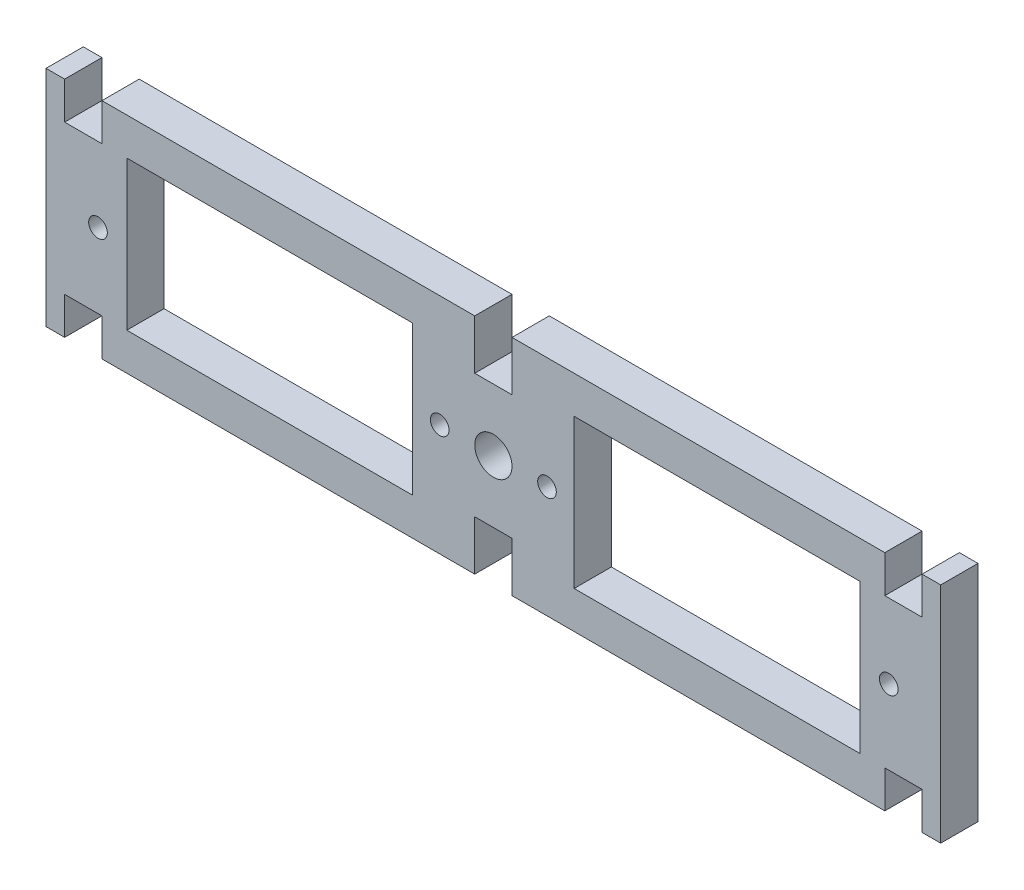
from build123d import *

# Parameters (mm, degrees)
SKETCH_1_R      = 1.499696603
SKETCH_1_R_2    = 0.75
EXTRUDE_1_DEPTH = 3


with BuildPart() as part:
    # 草图1 → 凸台-拉伸1 (new body)
    with BuildSketch(Plane.XY):
        Polygon((0, 0), (0, -18), (1.5, -18), (1.5, -15), (4.5, -15), (4.5, -18), (34.5, -18), (34.5, -14), (37.5, -14), (37.5, -18), (67.5, -18), (67.5, -15), (70.5, -15), (70.5, -18), (72, -18), (72, 0), (70.5, 0), (70.5, -3), (67.5, -3), (67.5, 0), (37.5, 0), (37.5, -4), (34.5, -4), (34.5, 0), (4.5, 0), (4.5, -3), (1.5, -3), (1.5, 0), align=None)
        with Locations((36, -9)):
            Circle(SKETCH_1_R, mode=Mode.SUBTRACT)
        with Locations((31.683762096, -9)):
            Circle(SKETCH_1_R_2, mode=Mode.SUBTRACT)
        with Locations((4.183762096, -9)):
            Circle(SKETCH_1_R_2, mode=Mode.SUBTRACT)
        with Locations(Location((67.816237904, -9, 0), (0, 0, 180))):
            Circle(SKETCH_1_R_2, mode=Mode.SUBTRACT)
        with Locations(Location((40.316237904, -9, 0), (0, 0, 180))):
            Circle(SKETCH_1_R_2, mode=Mode.SUBTRACT)
        Polygon((29.5, -9), (29.5, -15), (6.5, -15), (6.5, -3), (29.5, -3), align=None, mode=Mode.SUBTRACT)
        Polygon((42.5, -3), (42.5, -9), (42.5, -15), (65.5, -15), (65.5, -3), align=None, mode=Mode.SUBTRACT)
    extrude(amount=EXTRUDE_1_DEPTH)


solid = part.part
